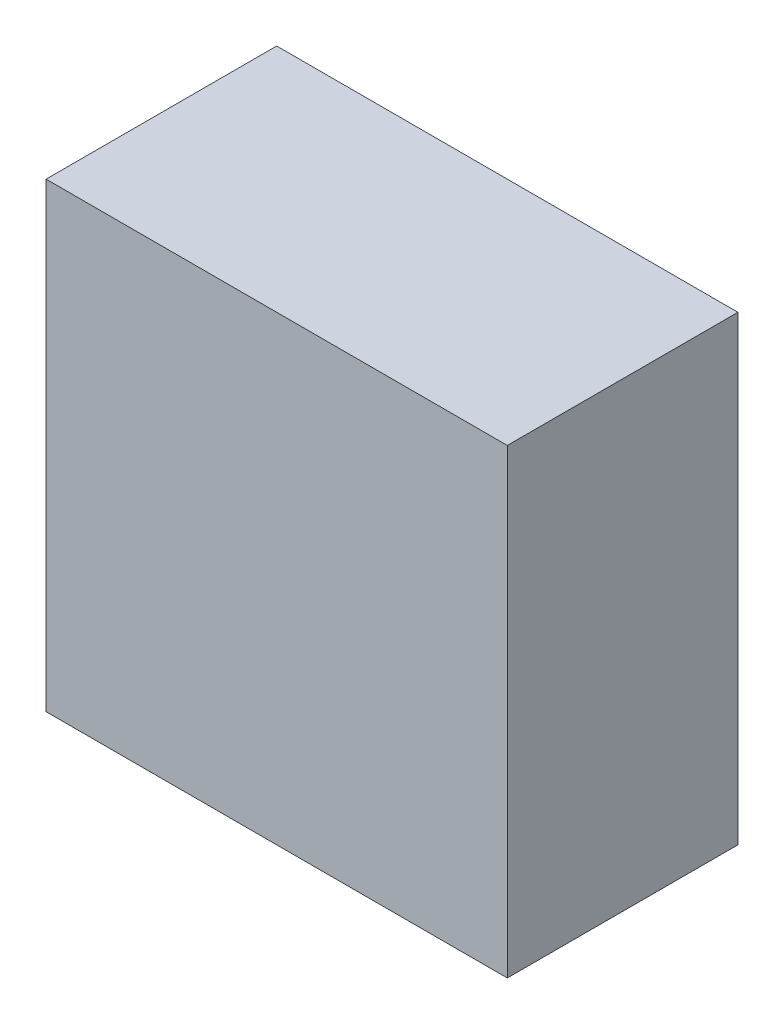
from build123d import *

# Parameters (mm, degrees)
SKETCH1_W               = 2
SKETCH1_H               = 2
COMPONENT_OUTLINE_DEPTH = 1


with BuildPart() as part:
    # Sketch1 → Component_Outline (new body)
    with BuildSketch(Plane.XY):
        Rectangle(SKETCH1_W, SKETCH1_H)
    extrude(amount=COMPONENT_OUTLINE_DEPTH)


solid = part.part
